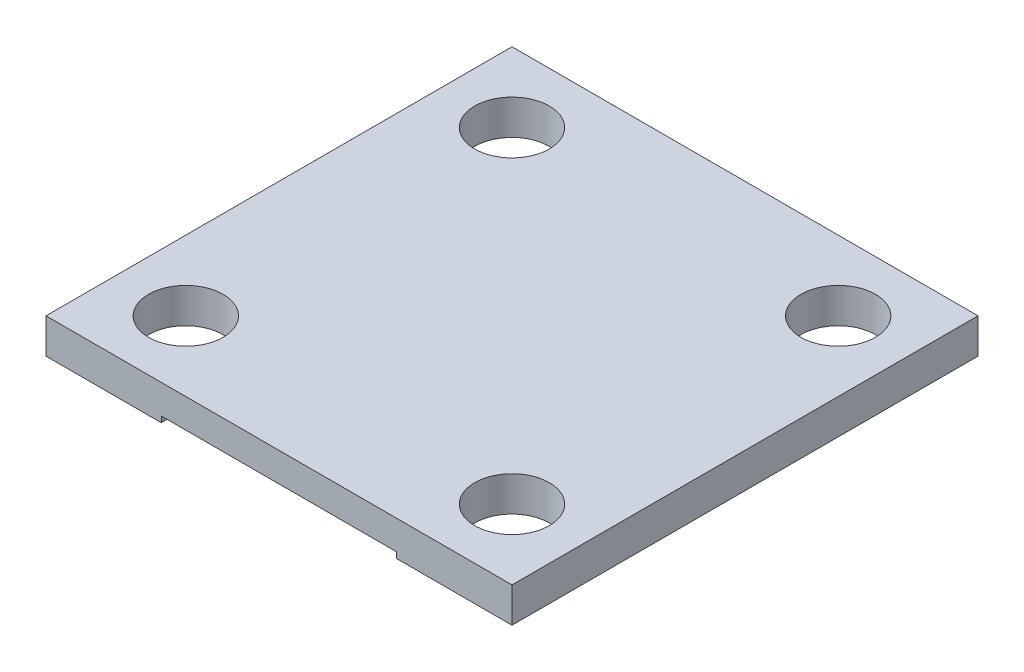
from build123d import *

# Parameters (mm, degrees)
SKETCH_1_W              = 20
SKETCH_1_H              = 20
EXTRUDE_1_DEPTH         = 1.5
SKETCH_2_W              = 10.1
SKETCH_2_H              = 17.5
CUT_EXTRUDE_1_DEPTH     = 0.25
HOLE_WIZARD_3_2_3_2_1_D = 3.2
HOLE_WIZARD_3_2_3_2_2_D = 3.2


with BuildPart() as part:
    # 草图1 → 凸台-拉伸1 (new body)
    with BuildSketch(Plane.XZ):
        Rectangle(SKETCH_1_W, SKETCH_1_H)
    extrude(amount=-EXTRUDE_1_DEPTH)

    # 草图2 → 切除-拉伸1 (cut)
    with BuildSketch(Plane.XZ):
        with Locations((0, 1.25)):
            Rectangle(SKETCH_2_W, SKETCH_2_H)
    extrude(amount=-CUT_EXTRUDE_1_DEPTH, mode=Mode.SUBTRACT)

    # Ø3.2 (3.2) 直径孔1 (through all)
    with Locations(Plane(origin=(0, 1.5, 0), x_dir=(1, 0, 0), z_dir=(0, 1, 0))):
        with Locations((-7, -7), (7, 7)):
            Hole(HOLE_WIZARD_3_2_3_2_1_D / 2)

    # Ø3.2 (3.2) 直径孔2 (through all)
    with Locations(Plane(origin=(0, 0, 0), x_dir=(-1, 0, 0), z_dir=(0, -1, 0))):
        with Locations((-7, -7), (7, 7)):
            Hole(HOLE_WIZARD_3_2_3_2_2_D / 2)


solid = part.part
